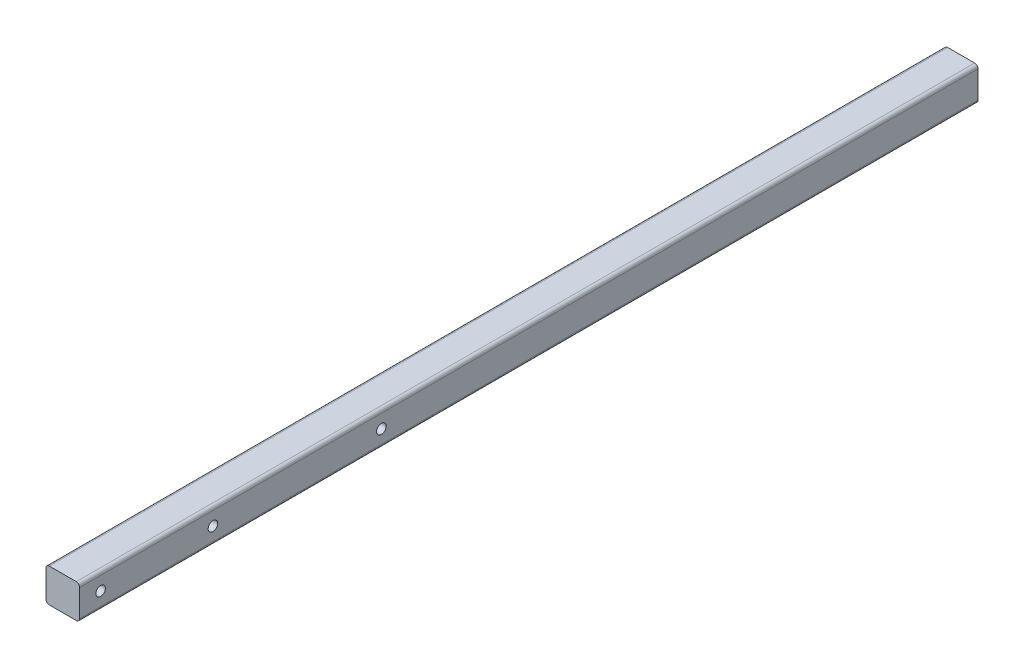
from build123d import *

# Parameters (mm, degrees)
SKETCH1_W                  = 800
SKETCH1_H                  = 30
BOSS_EXTRUDE1_DEPTH        = 30
F_8_5_8_5_DIAMETER_HOLE1_D = 8.5
FILLET1_R                  = 3


with BuildPart() as part:
    # Sketch1 → Boss-Extrude1 (new body)
    with BuildSketch(Plane(origin=(-284.1, 0, 0), x_dir=(0, 0, -1), z_dir=(1, 0, 0))):
        with Locations((-659.753768995, 522.880996201)):
            Rectangle(SKETCH1_W, SKETCH1_H)
    extrude(amount=-BOSS_EXTRUDE1_DEPTH)

    # Ø8.5 (8.5) Diameter Hole1 (through all)
    with Locations(Plane(origin=(-284.1, 0, 0), x_dir=(0, 0, -1), z_dir=(1, 0, 0))):
        with Locations((-791.091669843, 522.880996201), (-941.091669843, 522.880996201), (-1041.091669843, 522.880996201)):
            Hole(F_8_5_8_5_DIAMETER_HOLE1_D / 2)

    # Fillet1
    fillet1_edges = [part.edges().sort_by_distance(p)[0] for p in [
        (-314.1, 507.880996201, 659.753768995),
        (-314.1, 537.880996201, 659.753768995),
        (-284.1, 507.880996201, 659.753768995),
        (-284.1, 537.880996201, 659.753768995),
    ]]
    fillet(fillet1_edges, radius=FILLET1_R)


solid = part.part
